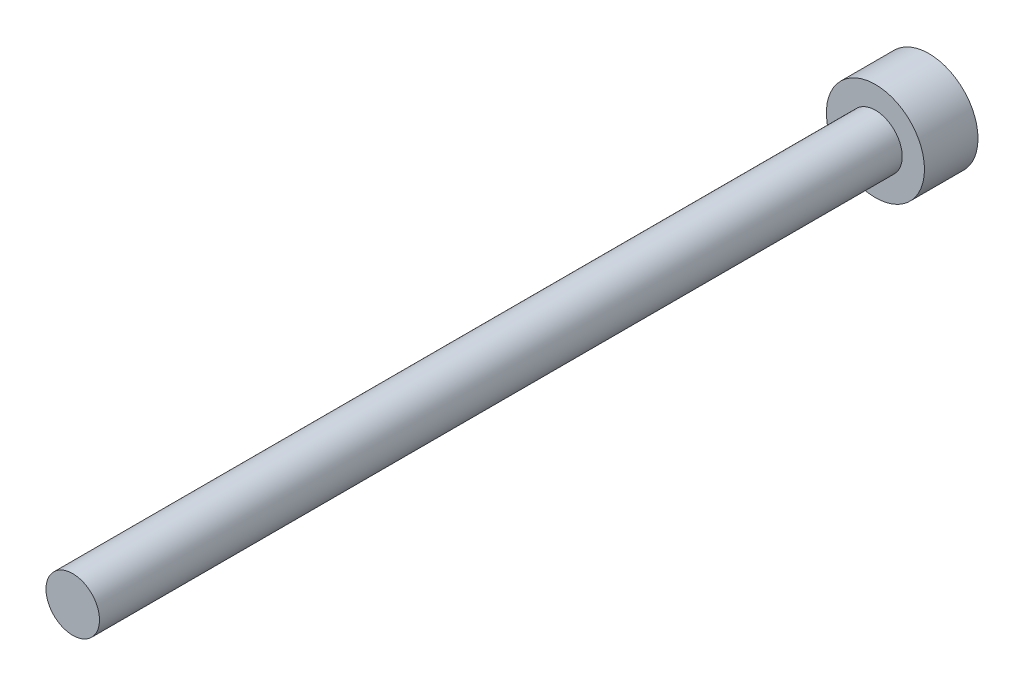
from build123d import *

# Parameters (mm, degrees)
F_01_START                = -3
S01_HEAD_R                = 2.75
F_01_HEAD_DEPTH           = 3
S02_NOMINAL_SHANK_R       = 1.5
F_02_NOMINAL_SHANK_DEPTH  = 45
F_03_START                = -3.1
F_03_HEX_KEY_SOCKET_DEPTH = 1.75


with BuildPart() as part:
    # S01 - Head → 01 - Head (new body)
    with BuildSketch(Plane.XY.offset(F_01_START)):
        Circle(S01_HEAD_R)
    extrude(amount=F_01_HEAD_DEPTH)

    # S02 - Nominal shank → 02 - Nominal shank (add)
    with BuildSketch(Plane.XY):
        with Locations(Location((0, 0, 0), (0, 0, 180))):
            Circle(S02_NOMINAL_SHANK_R)
    extrude(amount=F_02_NOMINAL_SHANK_DEPTH)

    # S03 - Hex key socket → 03 - Hex key socket (cut)
    with BuildSketch(Plane.XY.offset(F_03_START)):
        Polygon((1.443375673, 0), (0.721687836, 1.25), (-0.721687836, 1.25), (-1.443375673, 0), (-0.721687836, -1.25), (0.721687836, -1.25), align=None)
    extrude(amount=F_03_HEX_KEY_SOCKET_DEPTH, mode=Mode.SUBTRACT)


solid = part.part
